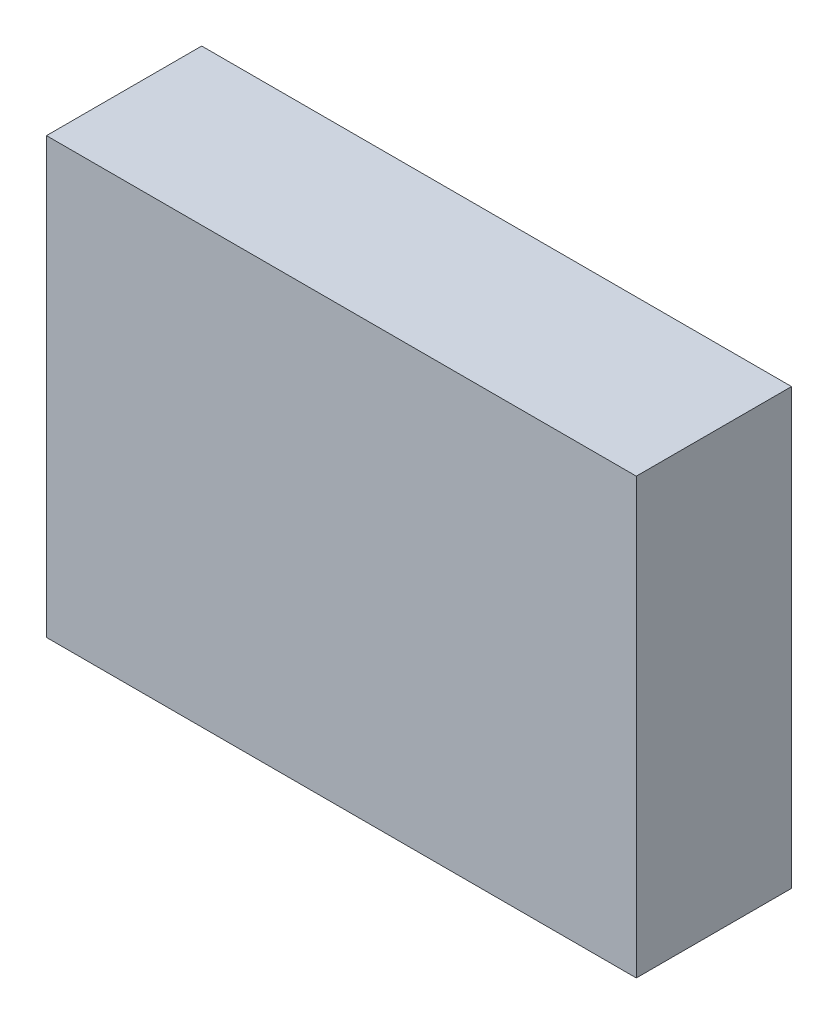
from build123d import *

# Parameters (mm, degrees)
SKETCH1_W           = 190
SKETCH1_H           = 140
BOSS_EXTRUDE1_DEPTH = 50


with BuildPart() as part:
    # Sketch1 → Boss-Extrude1 (new body)
    with BuildSketch(Plane.XY):
        Rectangle(SKETCH1_W, SKETCH1_H)
    extrude(amount=BOSS_EXTRUDE1_DEPTH)


solid = part.part
